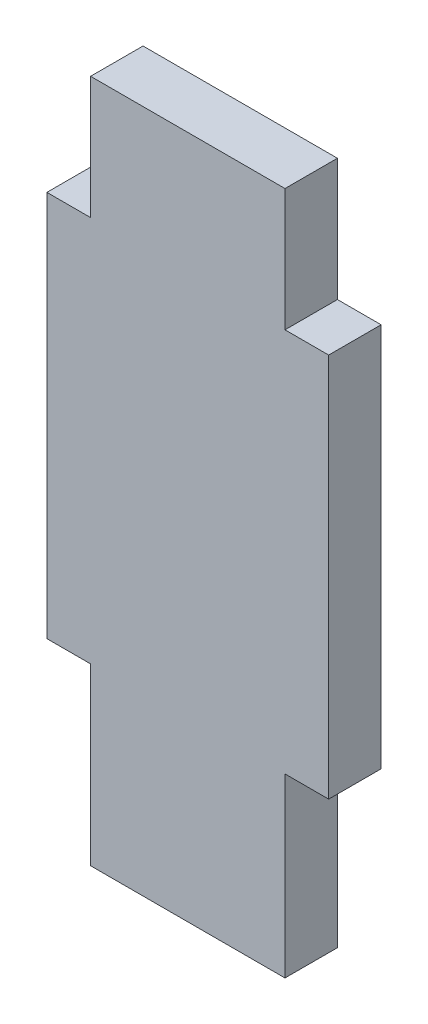
from build123d import *

# Parameters (mm, degrees)
BASE_EXTRUDE_DEPTH = 3


with BuildPart() as part:
    # Sketch1 → Base-Extrude (new body)
    with BuildSketch(Plane.XY):
        Polygon((704.392545339, -103.808025339), (701.892545339, -103.808025339), (701.892545339, -81.697887207), (704.392545339, -81.697887207), (704.392545339, -74.697887207), (715.512545339, -74.697887207), (715.512545339, -81.697887207), (718.011485221, -81.697887207), (718.011485221, -103.697887207), (715.512545339, -103.697887207), (715.512545339, -113.808025339), (704.392545339, -113.808025339), align=None)
    extrude(amount=BASE_EXTRUDE_DEPTH)


solid = part.part
